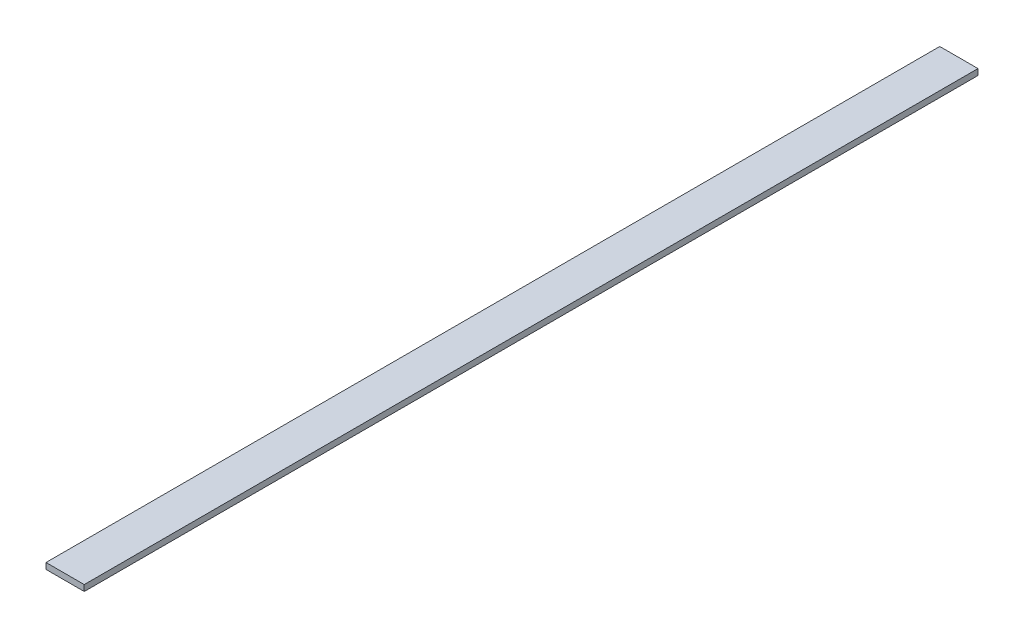
from build123d import *

# Parameters (mm, degrees)
SKETCH1_W           = 19
SKETCH1_H           = 444
BOSS_EXTRUDE1_DEPTH = 3


with BuildPart() as part:
    # Sketch1 → Boss-Extrude1 (new body)
    with BuildSketch(Plane(origin=(0, 0, 0), x_dir=(1, 0, 0), z_dir=(0, 1, 0))):
        Rectangle(SKETCH1_W, SKETCH1_H)
    extrude(amount=BOSS_EXTRUDE1_DEPTH)


solid = part.part
